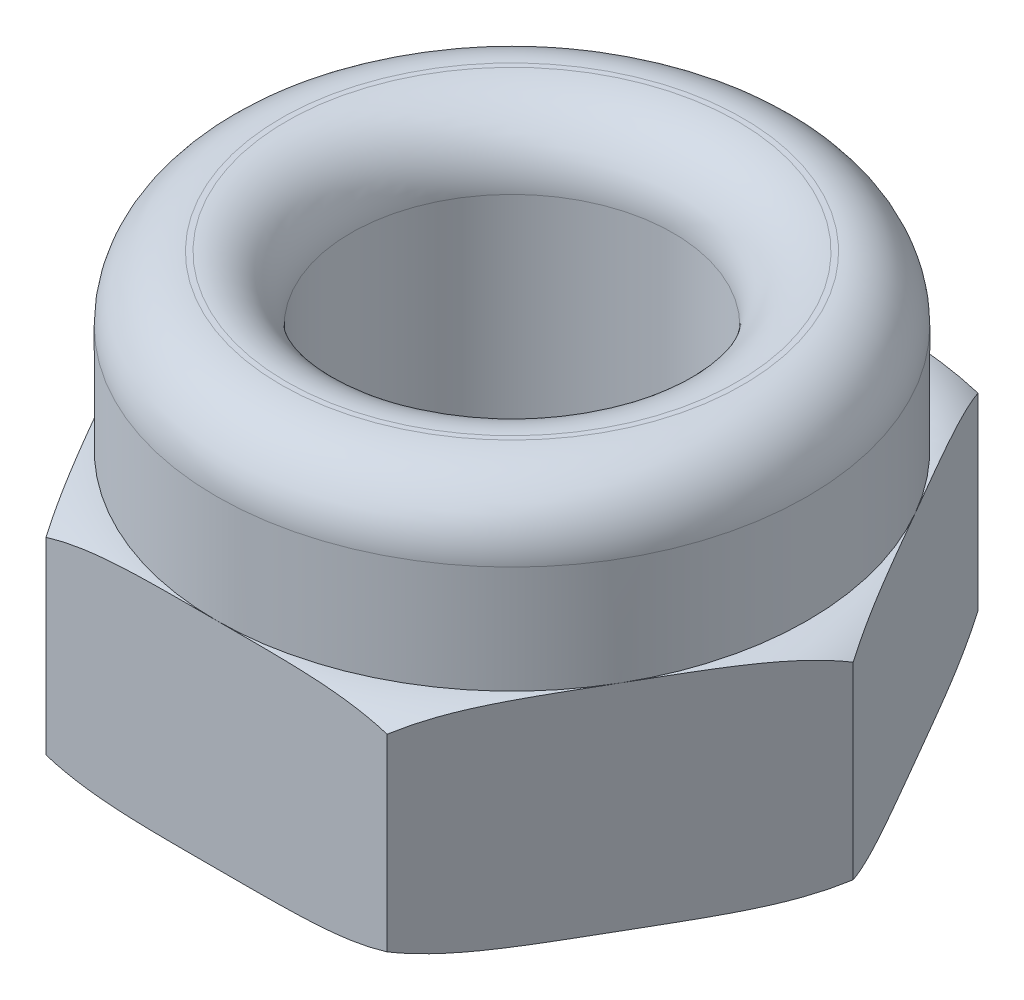
from build123d import *

# Parameters (mm, degrees)
SKETCH1_R           = 1.5
BOSS_EXTRUDE1_DEPTH = 1
BOSS_EXTRUDE2_START = -2
SKETCH3_R           = 1.5
BOSS_EXTRUDE2_DEPTH = 3.6
CHAMFER1_SIZE       = 0.2
FILLET1_R           = 0.6


with BuildPart() as part:
    # Sketch1 → Boss-Extrude1 (new, symmetric)
    with BuildSketch(Plane(origin=(0, 0, 0), x_dir=(1, 0, 0), z_dir=(0, 1, 0))):
        Polygon((3.175426481, 0), (1.58771324, 2.75), (-1.58771324, 2.75), (-3.175426481, 0), (-1.58771324, -2.75), (1.58771324, -2.75), align=None)
        with Locations(Location((0, 0, 0), (0, 0, 270))):
            Circle(SKETCH1_R, mode=Mode.SUBTRACT)
    extrude(amount=BOSS_EXTRUDE1_DEPTH, both=True)

    # Sketch2 → Cut-Revolve1 (revolve, cut)
    with BuildSketch(Plane.XY):
        with BuildLine():
            Line((-3.55, -0.2), (-3.55, -1))
            Line((-3.55, -1), (-2.75, -1))
            ThreePointArc((-2.75, -1), (-3.315685425, -0.765685425), (-3.55, -0.2))
        make_face()
    cut_revolve1 = revolve(axis=Axis((0, 0, 0), (0, 1, 0)), mode=Mode.SUBTRACT)

    # Mirror2: Cut-Revolve1 across plane
    add(cut_revolve1.mirror(Plane.ZX), mode=Mode.SUBTRACT)

    # Sketch3 → Boss-Extrude2 (add)
    with BuildSketch(Plane(origin=(0, 1, 0), x_dir=(1, 0, 0), z_dir=(0, 1, 0)).offset(BOSS_EXTRUDE2_START)):
        with BuildLine():
            ThreePointArc((-2.38156986, -1.375), (-1.375, -2.38156986), (0, -2.75))
            ThreePointArc((0, -2.75), (1.375, -2.38156986), (2.38156986, -1.375))
            ThreePointArc((2.38156986, -1.375), (2.75, 0), (2.38156986, 1.375))
            ThreePointArc((2.38156986, 1.375), (1.375, 2.38156986), (0, 2.75))
            ThreePointArc((0, 2.75), (-1.375, 2.38156986), (-2.38156986, 1.375))
            ThreePointArc((-2.38156986, 1.375), (-2.75, 0), (-2.38156986, -1.375))
        make_face()
        with Locations(Location((0, 0, 0), (0, 0, 270))):
            Circle(SKETCH3_R, mode=Mode.SUBTRACT)
    extrude(amount=BOSS_EXTRUDE2_DEPTH)

    # Chamfer1
    chamfer1_edges = [part.edges().sort_by_distance(p)[0] for p in [
        (0, -1, -1.5),
    ]]
    chamfer(chamfer1_edges, length=CHAMFER1_SIZE)

    # Fillet1
    fillet1_edges = [part.edges().sort_by_distance(p)[0] for p in [
        (0, 2.6, 2.75),
        (0, 2.6, -1.5),
    ]]
    fillet(fillet1_edges, radius=FILLET1_R)


solid = part.part
